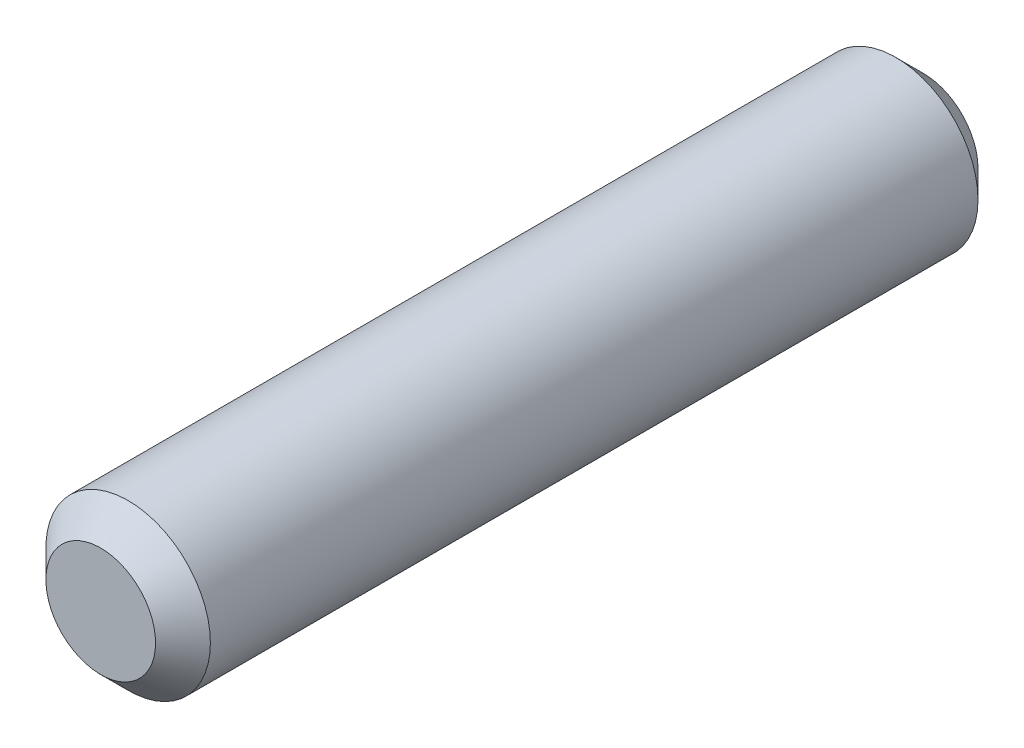
from build123d import *

# Parameters (mm, degrees)
SKETCH1_R           = 1.5
BOSS_EXTRUDE2_DEPTH = 15
CHAMFER2_SIZE       = 0.5


with BuildPart() as part:
    # Sketch1 → Boss-Extrude2 (new body)
    with BuildSketch(Plane.XY):
        Circle(SKETCH1_R)
    extrude(amount=BOSS_EXTRUDE2_DEPTH)

    # Chamfer2
    chamfer2_edges = [part.edges().sort_by_distance(p)[0] for p in [
        (-1.5, 0, 0),
        (-1.5, 0, 15),
    ]]
    chamfer(chamfer2_edges, length=CHAMFER2_SIZE)


solid = part.part
